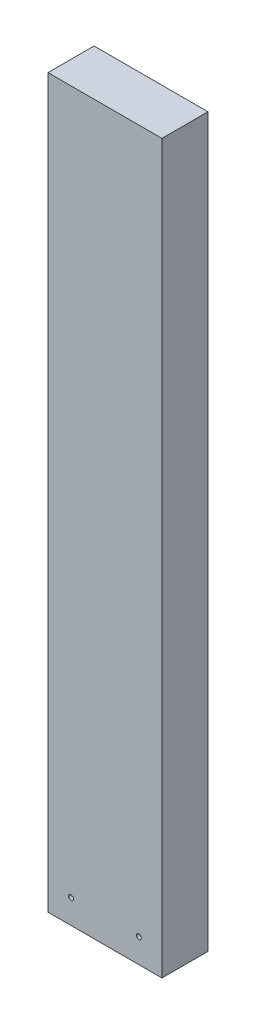
from build123d import *

# Parameters (mm, degrees)
SKETCH1_W           = 47
SKETCH1_H           = 300
SKETCH1_R           = 1
BOSS_EXTRUDE1_DEPTH = 19


with BuildPart() as part:
    # Sketch1 → Boss-Extrude1 (new body)
    with BuildSketch(Plane.XY):
        Rectangle(SKETCH1_W, SKETCH1_H)
        with Locations((-14, -140)):
            Circle(SKETCH1_R, mode=Mode.SUBTRACT)
        with Locations((14, -140)):
            Circle(SKETCH1_R, mode=Mode.SUBTRACT)
    extrude(amount=BOSS_EXTRUDE1_DEPTH)


solid = part.part
